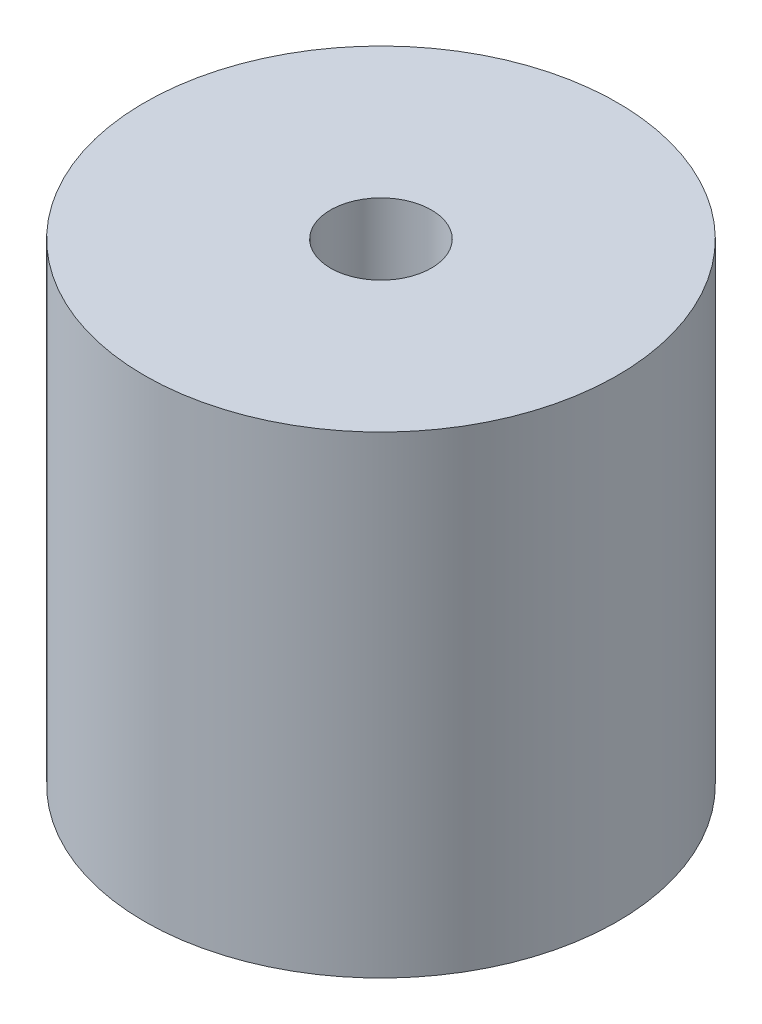
from build123d import *

# Parameters (mm, degrees)
SKETCH1_R           = 7.5
SKETCH1_R_2         = 1.6
BOSS_EXTRUDE1_DEPTH = 15


with BuildPart() as part:
    # Sketch1 → Boss-Extrude1 (new body)
    with BuildSketch(Plane(origin=(0, 0, 0), x_dir=(1, 0, 0), z_dir=(0, 1, 0))):
        with Locations(Location((0, 0, 0), (0, 0, 270))):
            Circle(SKETCH1_R)
        with Locations(Location((0, 0, 0), (0, 0, 270))):
            Circle(SKETCH1_R_2, mode=Mode.SUBTRACT)
    extrude(amount=BOSS_EXTRUDE1_DEPTH)


solid = part.part
